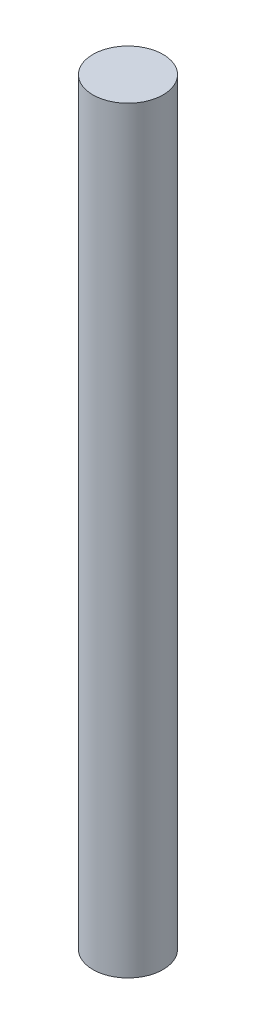
from build123d import *

# Parameters (mm, degrees)
SKETCH_1_R      = 25
EXTRUDE_1_DEPTH = 540


with BuildPart() as part:
    # 草图1 → 凸台-拉伸1 (new body)
    with BuildSketch(Plane(origin=(0, 0, 0), x_dir=(1, 0, 0), z_dir=(0, 1, 0))):
        with Locations(Location((0, 0, 0), (0, 0, 270))):
            Circle(SKETCH_1_R)
    extrude(amount=EXTRUDE_1_DEPTH)


solid = part.part
